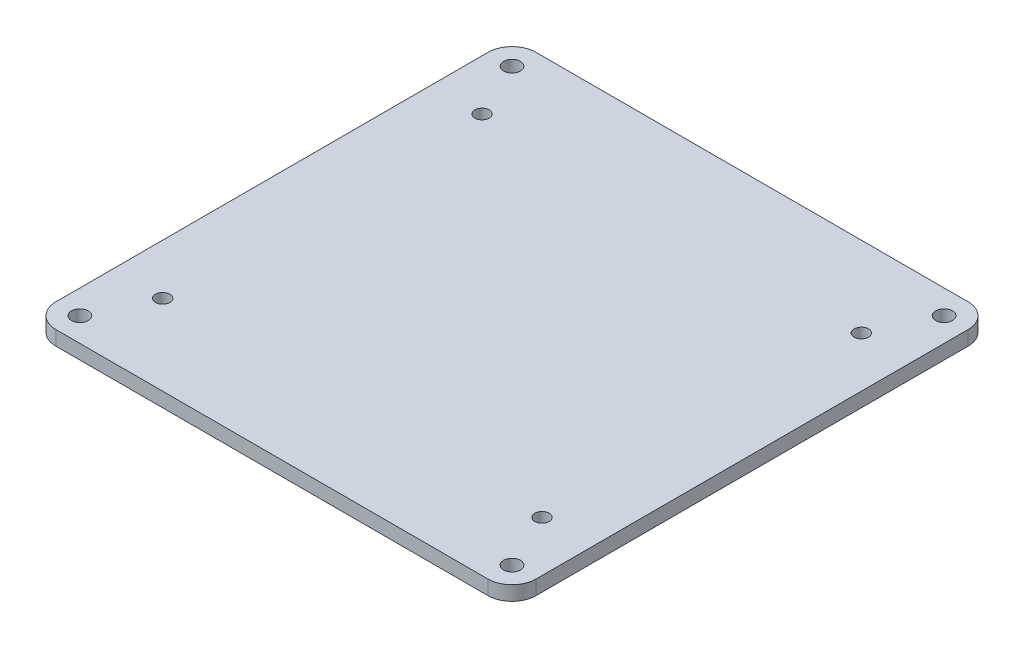
from build123d import *

# Parameters (mm, degrees)
SKETCH_1_R      = 1.75
SKETCH_1_R_2    = 1.5
EXTRUDE_1_DEPTH = 3


with BuildPart() as part:
    # 草图1 → 凸台-拉伸1 (new body)
    with BuildSketch(Plane(origin=(0, 0, 0), x_dir=(1, 0, 0), z_dir=(0, 1, 0))):
        with BuildLine():
            Line((-45, 50), (45, 50))
            ThreePointArc((45, 50), (48.535533906, 48.535533906), (50, 45))
            Line((50, 45), (50, -45))
            ThreePointArc((50, -45), (48.535533906, -48.535533906), (45, -50))
            Line((45, -50), (-45, -50))
            ThreePointArc((-45, -50), (-48.535533906, -48.535533906), (-50, -45))
            Line((-50, -45), (-50, 45))
            ThreePointArc((-50, 45), (-48.535533906, 48.535533906), (-45, 50))
        make_face()
        with Locations(Location((-45, 45, 0), (0, 0, 270))):
            Circle(SKETCH_1_R, mode=Mode.SUBTRACT)
        with Locations(Location((45, 45, 0), (0, 0, 270))):
            Circle(SKETCH_1_R, mode=Mode.SUBTRACT)
        with Locations(Location((-45, -45, 0), (0, 0, 270))):
            Circle(SKETCH_1_R, mode=Mode.SUBTRACT)
        with Locations(Location((45, -45, 0), (0, 0, 270))):
            Circle(SKETCH_1_R, mode=Mode.SUBTRACT)
        with Locations(Location((-39.5, 33.25, 0), (0, 0, 270))):
            Circle(SKETCH_1_R_2, mode=Mode.SUBTRACT)
        with Locations(Location((39.5, 33.25, 0), (0, 0, 270))):
            Circle(SKETCH_1_R_2, mode=Mode.SUBTRACT)
        with Locations(Location((-39.5, -33.25, 0), (0, 0, 270))):
            Circle(SKETCH_1_R_2, mode=Mode.SUBTRACT)
        with Locations(Location((39.5, -33.25, 0), (0, 0, 270))):
            Circle(SKETCH_1_R_2, mode=Mode.SUBTRACT)
    extrude(amount=EXTRUDE_1_DEPTH)


solid = part.part
